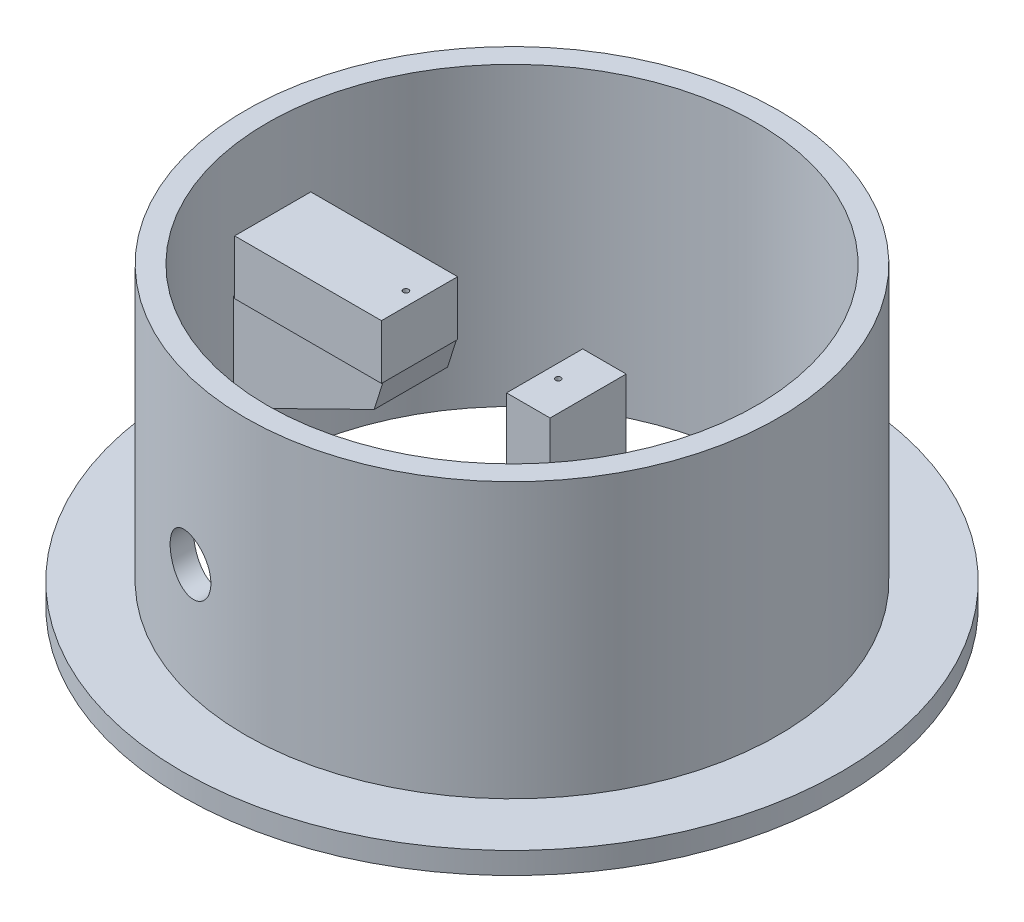
from build123d import *

# Parameters (mm, degrees)
SKETCH1_R             = 60.625
SKETCH1_R_2           = 45
BOSS_EXTRUDE1_DEPTH   = 4
SKETCH2_R             = 49
SKETCH2_R_2           = 45
BOSS_EXTRUDE2_DEPTH   = 50.5
SKETCH4_W             = 8
SKETCH4_H             = 40.5
BOSS_EXTRUDE4_DEPTH   = 7
SKETCH4_W_2           = 27
SKETCH4_H_2           = 10
BOSS_EXTRUDE4_2_DEPTH = 7
BOSS_EXTRUDE5_DEPTH   = 4
SKETCH6_R             = 5
CUT_EXTRUDE2_DEPTH    = 52
CUT_EXTRUDE6_DEPTH    = 100.503925853
SKETCH15_R            = 0.5
CUT_EXTRUDE7_DEPTH    = 4.5
SKETCH15_3_R          = 0.5
CUT_EXTRUDE8_DEPTH    = 4.5
BOSS_EXTRUDE6_DEPTH   = 6.75


with BuildPart() as part:
    # Sketch1 → Boss-Extrude1 (new body)
    with BuildSketch(Plane(origin=(0, 0, 0), x_dir=(1, 0, 0), z_dir=(0, 1, 0))):
        with Locations(Location((0, 0, 0), (0, 0, 270))):
            Circle(SKETCH1_R)
        with Locations(Location((0, 0, 0), (0, 0, 270))):
            Circle(SKETCH1_R_2, mode=Mode.SUBTRACT)
    extrude(amount=BOSS_EXTRUDE1_DEPTH)

    # Sketch2 → Boss-Extrude2 (add)
    with BuildSketch(Plane(origin=(0, 4, 0), x_dir=(1, 0, 0), z_dir=(0, 1, 0))):
        with Locations(Location((0, 0, 0), (0, 0, 270))):
            Circle(SKETCH2_R)
        with Locations(Location((0, 0, 0), (0, 0, 270))):
            Circle(SKETCH2_R_2, mode=Mode.SUBTRACT)
    extrude(amount=BOSS_EXTRUDE2_DEPTH)



with BuildPart() as body_2:
    # Sketch4 → Boss-Extrude4 (new, symmetric)
    with BuildSketch(Plane.XY):
        with Locations((10, 20.25)):
            Rectangle(SKETCH4_W, SKETCH4_H)
    extrude(amount=BOSS_EXTRUDE4_DEPTH, both=True)


with BuildPart() as body_3:
    # Sketch4 → Boss-Extrude4 2 (new, symmetric)
    with BuildSketch(Plane.XY):
        with Locations((-30.5, 35.5)):
            Rectangle(SKETCH4_W_2, SKETCH4_H_2)
    extrude(amount=BOSS_EXTRUDE4_2_DEPTH, both=True)

    # Sketch15<3> → Cut-Extrude8 (cut)
    with BuildSketch(Plane(origin=(0, 40.5, 0), x_dir=(1, 0, 0), z_dir=(0, 1, 0))):
        with Locations(Location((-19.5, 0, 0), (0, 0, 270))):
            Circle(SKETCH15_3_R)
        with Locations(Location((8.5, 0, 0), (0, 0, 270))):
            Circle(SKETCH15_3_R)
    extrude(amount=-CUT_EXTRUDE8_DEPTH, mode=Mode.SUBTRACT)


with BuildPart() as part_1:
    add(part.part)

    add(body_2.part)  # Boss-Extrude5 merges body 2
    # Sketch5 → Boss-Extrude5 (add)
    with BuildSketch(Plane(origin=(0, 0, 0.832419338), x_dir=(1, 0, 0), z_dir=(0, -1, 0))):
        with BuildLine():
            Line((0.92268666, 14.579552818), (36.10584122, 30.137929754))
            ThreePointArc((36.10584122, 30.137929754), (47.46850162, -1.287411864), (36.651216878, -32.904630242))
            Line((36.651216878, -32.904630242), (0.92268666, -16.029114558))
            Line((0.92268666, -16.029114558), (0.92268666, 14.579552818))
        make_face()
    extrude(amount=-BOSS_EXTRUDE5_DEPTH)

    # Sketch6 → Cut-Extrude2 (cut)
    with BuildSketch(Plane.XY):
        with Locations(Location((-11.847358964, 24.485616242, 0), (0, 0, 180))):
            Circle(SKETCH6_R)
    extrude(amount=CUT_EXTRUDE2_DEPTH, mode=Mode.SUBTRACT)

    # Sketch11 → Cut-Extrude6 (cut, through all)
    with BuildSketch(Plane(origin=(0, 4, 0), x_dir=(1, 0, 0), z_dir=(0, 1, 0))):
        with BuildLine():
            Line((16.265526008, 12.732401326), (16.265526008, -6.549664017))
            Line((16.265526008, -6.549664017), (5.714961953, -6.549664017))
            Line((5.714961953, -6.549664017), (5.714961953, -11.643039768))
            Line((5.714961953, -11.643039768), (30.818028154, -22.557416377))
            ThreePointArc((30.818028154, -22.557416377), (39.374347706, -1.214976289), (32.152007517, 20.615006655))
            Line((32.152007517, 20.615006655), (16.265526008, 12.732401326))
        make_face()
    extrude(amount=-CUT_EXTRUDE6_DEPTH, mode=Mode.SUBTRACT)

    # Sketch15 → Cut-Extrude7 (cut)
    with BuildSketch(Plane(origin=(0, 40.5, 0), x_dir=(1, 0, 0), z_dir=(0, 1, 0))):
        with Locations((-19.5, 0)):
            Circle(SKETCH15_R)
        with Locations(Location((8.5, 0, 0), (0, 0, 270))):
            Circle(SKETCH15_R)
    extrude(amount=-CUT_EXTRUDE7_DEPTH, mode=Mode.SUBTRACT)


    add(body_3.part)  # Boss-Extrude6 merges body 3
    # Sketch17 → Boss-Extrude6 (add, symmetric)
    with BuildSketch(Plane.XY):
        Polygon((-17, 30.5), (-45, 30.5), (-45, 12.445827276), (-18.590132897, 25.433454532), align=None)
    extrude(amount=BOSS_EXTRUDE6_DEPTH, both=True)


solid = part_1.part
